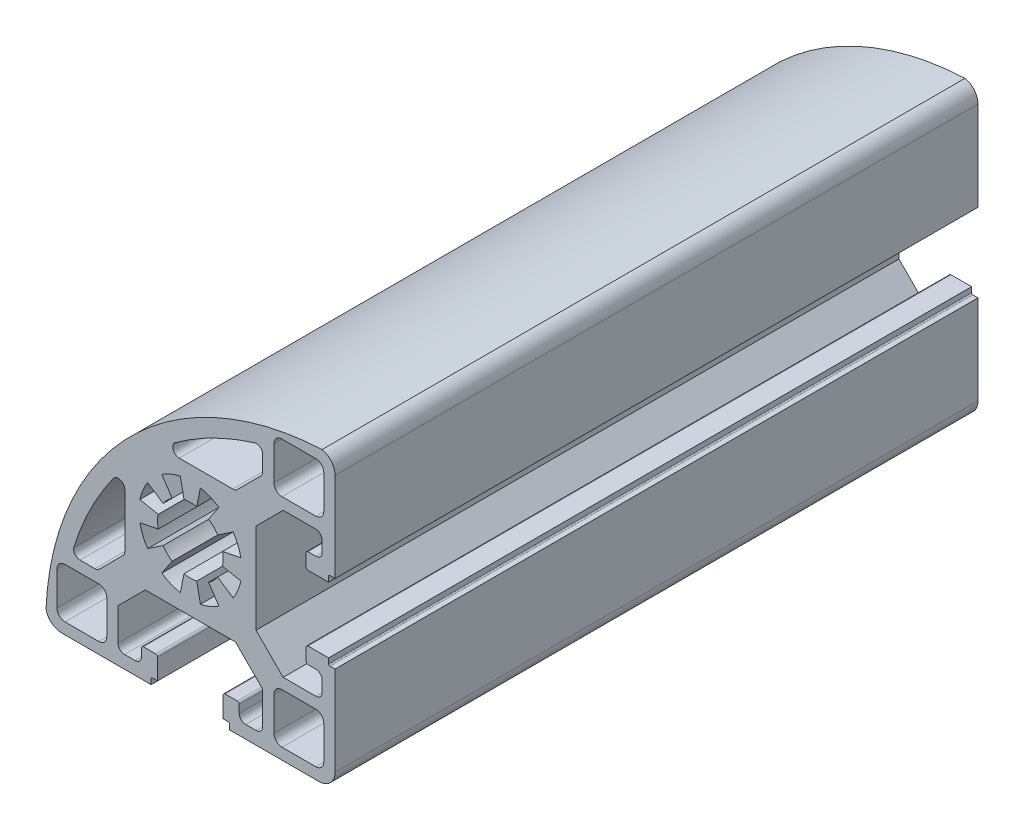
from build123d import *

# Parameters (mm, degrees)
EXTRUDE_1_DEPTH = 100


with BuildPart() as part:
    # 草图1 → 凸台-拉伸1 (new body)
    with BuildSketch(Plane.XY):
        with BuildLine():
            Line((23.205623676, 19.265775848), (23.205623676, 5.365775848))
            Line((23.205623676, 5.365775848), (22.405623676, 5.365775848))
            ThreePointArc((22.405623676, 5.365775848), (22.264202319, 5.307197204), (22.205623676, 5.165775848))
            Line((22.205623676, 5.165775848), (22.205623676, 4.365775848))
            Line((22.205623676, 4.365775848), (19.005623676, 4.365775848))
            ThreePointArc((19.005623676, 4.365775848), (18.793491641, 4.453643813), (18.705623676, 4.665775848))
            Line((18.705623676, 4.665775848), (18.705623676, 6.565775848))
            ThreePointArc((18.705623676, 6.565775848), (18.793491641, 6.777907882), (19.005623676, 6.865775848))
            Line((19.005623676, 6.865775848), (20.205623676, 6.865775848))
            ThreePointArc((20.205623676, 6.865775848), (20.912730457, 7.158669066), (21.205623676, 7.865775848))
            Line((21.205623676, 7.865775848), (21.205623676, 9.515775848))
            ThreePointArc((21.205623676, 9.515775848), (20.912730457, 10.222882629), (20.205623676, 10.515775848))
            Line((20.205623676, 10.515775848), (15.137604191, 10.515775848))
            Line((15.137604191, 10.515775848), (10.905623676, 6.283795332))
            Line((10.905623676, 6.283795332), (10.905623676, -7.752243637))
            Line((10.905623676, -7.752243637), (15.137604191, -11.984224152))
            Line((15.137604191, -11.984224152), (20.205623676, -11.984224152))
            ThreePointArc((20.205623676, -11.984224152), (20.912730457, -11.691330934), (21.205623676, -10.984224152))
            Line((21.205623676, -10.984224152), (21.205623676, -9.334224152))
            ThreePointArc((21.205623676, -9.334224152), (20.912730457, -8.627117371), (20.205623676, -8.334224152))
            Line((20.205623676, -8.334224152), (19.005623676, -8.334224152))
            ThreePointArc((19.005623676, -8.334224152), (18.793491641, -8.246356187), (18.705623676, -8.034224152))
            Line((18.705623676, -8.034224152), (18.705623676, -6.134224152))
            ThreePointArc((18.705623676, -6.134224152), (18.793491641, -5.922092118), (19.005623676, -5.834224152))
            Line((19.005623676, -5.834224152), (22.205623676, -5.834224152))
            Line((22.205623676, -5.834224152), (22.205623676, -6.634224152))
            ThreePointArc((22.205623676, -6.634224152), (22.264202319, -6.775645509), (22.405623676, -6.834224152))
            Line((22.405623676, -6.834224152), (23.205623676, -6.834224152))
            Line((23.205623676, -6.834224152), (23.205623676, -20.734224152))
            ThreePointArc((23.205623676, -20.734224152), (22.473390628, -22.501991105), (20.705623676, -23.234224152))
            Line((20.705623676, -23.234224152), (6.805623676, -23.234224152))
            Line((6.805623676, -23.234224152), (6.805623676, -22.434224152))
            ThreePointArc((6.805623676, -22.434224152), (6.747045032, -22.292802796), (6.605623676, -22.234224152))
            Line((6.605623676, -22.234224152), (5.805623676, -22.234224152))
            Line((5.805623676, -22.234224152), (5.805623676, -19.034224152))
            ThreePointArc((5.805623676, -19.034224152), (5.893491641, -18.822092118), (6.105623676, -18.734224152))
            Line((6.105623676, -18.734224152), (8.005623676, -18.734224152))
            ThreePointArc((8.005623676, -18.734224152), (8.21775571, -18.822092118), (8.305623676, -19.034224152))
            Line((8.305623676, -19.034224152), (8.305623676, -20.234224152))
            ThreePointArc((8.305623676, -20.234224152), (8.598516894, -20.941330934), (9.305623676, -21.234224152))
            Line((9.305623676, -21.234224152), (10.955623676, -21.234224152))
            ThreePointArc((10.955623676, -21.234224152), (11.662730457, -20.941330934), (11.955623676, -20.234224152))
            Line((11.955623676, -20.234224152), (11.955623676, -15.166204668))
            Line((11.955623676, -15.166204668), (7.72364316, -10.934224152))
            Line((7.72364316, -10.934224152), (-6.312395809, -10.934224152))
            Line((-6.312395809, -10.934224152), (-10.544376324, -15.166204668))
            Line((-10.544376324, -15.166204668), (-10.544376324, -20.234224152))
            ThreePointArc((-10.544376324, -20.234224152), (-10.251483106, -20.941330934), (-9.544376324, -21.234224152))
            Line((-9.544376324, -21.234224152), (-7.894376324, -21.234224152))
            ThreePointArc((-7.894376324, -21.234224152), (-7.187269543, -20.941330934), (-6.894376324, -20.234224152))
            Line((-6.894376324, -20.234224152), (-6.894376324, -19.034224152))
            ThreePointArc((-6.894376324, -19.034224152), (-6.806508359, -18.822092118), (-6.594376324, -18.734224152))
            Line((-6.594376324, -18.734224152), (-4.694376324, -18.734224152))
            ThreePointArc((-4.694376324, -18.734224152), (-4.48224429, -18.822092118), (-4.394376324, -19.034224152))
            Line((-4.394376324, -19.034224152), (-4.394376324, -22.234224152))
            Line((-4.394376324, -22.234224152), (-5.194376324, -22.234224152))
            ThreePointArc((-5.194376324, -22.234224152), (-5.335797681, -22.292802796), (-5.394376324, -22.434224152))
            Line((-5.394376324, -22.434224152), (-5.394376324, -23.234224152))
            Line((-5.394376324, -23.234224152), (-19.294376324, -23.234224152))
            ThreePointArc((-19.294376324, -23.234224152), (-20.885291152, -22.66269246), (-21.748799384, -21.209416162))
            ThreePointArc((-21.748799384, -21.209416162), (-8.614181478, 8.585581001), (21.180815685, 21.720198907))
            ThreePointArc((21.180815685, 21.720198907), (22.634091983, 20.856690675), (23.205623676, 19.265775848))
        make_face()
        with BuildLine():
            Line((20.205623676, 12.265775848), (14.955623676, 12.265775848))
            ThreePointArc((14.955623676, 12.265775848), (14.071740199, 12.631892371), (13.705623676, 13.515775848))
            Line((13.705623676, 13.515775848), (13.705623676, 18.765775848))
            ThreePointArc((13.705623676, 18.765775848), (14.071740199, 19.649659324), (14.955623676, 20.015775848))
            Line((14.955623676, 20.015775848), (20.205623676, 20.015775848))
            ThreePointArc((20.205623676, 20.015775848), (21.089507152, 19.649659324), (21.455623676, 18.765775848))
            Line((21.455623676, 18.765775848), (21.455623676, 13.515775848))
            ThreePointArc((21.455623676, 13.515775848), (21.089507152, 12.631892371), (20.205623676, 12.265775848))
        make_face(mode=Mode.SUBTRACT)
        with BuildLine():
            Line((-18.794376324, -13.734224152), (-13.544376324, -13.734224152))
            ThreePointArc((-13.544376324, -13.734224152), (-12.660492848, -14.100340676), (-12.294376324, -14.984224152))
            Line((-12.294376324, -14.984224152), (-12.294376324, -20.234224152))
            ThreePointArc((-12.294376324, -20.234224152), (-12.660492848, -21.118107629), (-13.544376324, -21.484224152))
            Line((-13.544376324, -21.484224152), (-18.794376324, -21.484224152))
            ThreePointArc((-18.794376324, -21.484224152), (-19.678259801, -21.118107629), (-20.044376324, -20.234224152))
            Line((-20.044376324, -20.234224152), (-20.044376324, -14.984224152))
            ThreePointArc((-20.044376324, -14.984224152), (-19.678259801, -14.100340676), (-18.794376324, -13.734224152))
        make_face(mode=Mode.SUBTRACT)
        with BuildLine():
            Line((20.205623676, -13.734224152), (14.955623676, -13.734224152))
            ThreePointArc((14.955623676, -13.734224152), (14.071740199, -14.100340676), (13.705623676, -14.984224152))
            Line((13.705623676, -14.984224152), (13.705623676, -20.234224152))
            ThreePointArc((13.705623676, -20.234224152), (14.071740199, -21.118107629), (14.955623676, -21.484224152))
            Line((14.955623676, -21.484224152), (20.205623676, -21.484224152))
            ThreePointArc((20.205623676, -21.484224152), (21.089507152, -21.118107629), (21.455623676, -20.234224152))
            Line((21.455623676, -20.234224152), (21.455623676, -14.984224152))
            ThreePointArc((21.455623676, -14.984224152), (21.089507152, -14.100340676), (20.205623676, -13.734224152))
        make_face(mode=Mode.SUBTRACT)
        with BuildLine():
            Line((-3.738938189, -7.385981051), (-2.127784513, -4.974719175))
            ThreePointArc((-2.127784513, -4.974719175), (-2.900620909, -4.340468736), (-3.534871347, -3.567632341))
            Line((-3.534871347, -3.567632341), (-5.946133223, -5.178786017))
            ThreePointArc((-5.946133223, -5.178786017), (-6.685412585, -3.795691611), (-7.140658568, -2.294946729))
            Line((-7.140658568, -2.294946729), (-4.296381255, -1.729184795))
            ThreePointArc((-4.296381255, -1.729184795), (-4.394376324, -0.734224152), (-4.296381255, 0.26073649))
            Line((-4.296381255, 0.26073649), (-7.140658568, 0.826498424))
            ThreePointArc((-7.140658568, 0.826498424), (-6.685412585, 2.327243307), (-5.946133223, 3.710337712))
            Line((-5.946133223, 3.710337712), (-3.534871347, 2.099184036))
            ThreePointArc((-3.534871347, 2.099184036), (-2.900620909, 2.872020432), (-2.127784513, 3.50627087))
            Line((-2.127784513, 3.50627087), (-3.738938189, 5.917532746))
            ThreePointArc((-3.738938189, 5.917532746), (-2.355843783, 6.656812108), (-0.855098901, 7.112058091))
            Line((-0.855098901, 7.112058091), (-0.289336967, 4.267780778))
            ThreePointArc((-0.289336967, 4.267780778), (0.705623676, 4.365775848), (1.700584318, 4.267780778))
            Line((1.700584318, 4.267780778), (2.266346252, 7.112058091))
            ThreePointArc((2.266346252, 7.112058091), (3.767091134, 6.656812108), (5.15018554, 5.917532746))
            Line((5.15018554, 5.917532746), (3.539031864, 3.50627087))
            ThreePointArc((3.539031864, 3.50627087), (4.31186826, 2.872020432), (4.946118698, 2.099184036))
            Line((4.946118698, 2.099184036), (7.357380574, 3.710337712))
            ThreePointArc((7.357380574, 3.710337712), (8.096659936, 2.327243307), (8.551905919, 0.826498424))
            Line((8.551905919, 0.826498424), (5.707628606, 0.26073649))
            ThreePointArc((5.707628606, 0.26073649), (5.805623676, -0.734224152), (5.707628606, -1.729184795))
            Line((5.707628606, -1.729184795), (8.551905919, -2.294946729))
            ThreePointArc((8.551905919, -2.294946729), (8.096659936, -3.795691611), (7.357380574, -5.178786017))
            Line((7.357380574, -5.178786017), (4.946118698, -3.567632341))
            ThreePointArc((4.946118698, -3.567632341), (4.31186826, -4.340468736), (3.539031864, -4.974719175))
            Line((3.539031864, -4.974719175), (5.15018554, -7.385981051))
            ThreePointArc((5.15018554, -7.385981051), (3.767091134, -8.125260412), (2.266346252, -8.580506396))
            Line((2.266346252, -8.580506396), (1.700584318, -5.736229082))
            ThreePointArc((1.700584318, -5.736229082), (0.705623676, -5.834224152), (-0.289336967, -5.736229082))
            Line((-0.289336967, -5.736229082), (-0.855098901, -8.580506396))
            ThreePointArc((-0.855098901, -8.580506396), (-2.355843783, -8.125260412), (-3.738938189, -7.385981051))
        make_face(mode=Mode.SUBTRACT)
        with BuildLine():
            Line((11.955623676, 16.425008073), (11.955623676, 14.111969925))
            ThreePointArc((11.955623676, 14.111969925), (11.879503208, 13.729286493), (11.662730457, 13.404863144))
            Line((11.662730457, 13.404863144), (8.016536379, 9.758669066))
            ThreePointArc((8.016536379, 9.758669066), (7.69211303, 9.541896315), (7.309429598, 9.465775848))
            Line((7.309429598, 9.465775848), (-1.034553488, 9.465775848))
            ThreePointArc((-1.034553488, 9.465775848), (-1.95892278, 10.084276945), (-1.739845229, 11.174693022))
            ThreePointArc((-1.739845229, 11.174693022), (4.264338796, 14.811507896), (10.785263601, 17.410389951))
            ThreePointArc((10.785263601, 17.410389951), (11.599688861, 17.189978685), (11.955623676, 16.425008073))
        make_face(mode=Mode.SUBTRACT)
        with BuildLine():
            Line((-16.45360855, -11.984224152), (-14.140570402, -11.984224152))
            ThreePointArc((-14.140570402, -11.984224152), (-13.75788697, -11.908103685), (-13.433463621, -11.691330934))
            Line((-13.433463621, -11.691330934), (-9.787269543, -8.045136856))
            ThreePointArc((-9.787269543, -8.045136856), (-9.570496792, -7.720713507), (-9.494376324, -7.338030075))
            Line((-9.494376324, -7.338030075), (-9.494376324, 1.005953011))
            ThreePointArc((-9.494376324, 1.005953011), (-10.112877422, 1.930322303), (-11.203293499, 1.711244752))
            ThreePointArc((-11.203293499, 1.711244752), (-14.840108373, -4.292939273), (-17.438990428, -10.813864078))
            ThreePointArc((-17.438990428, -10.813864078), (-17.218579162, -11.628289338), (-16.45360855, -11.984224152))
        make_face(mode=Mode.SUBTRACT)
    extrude(amount=EXTRUDE_1_DEPTH)


solid = part.part
